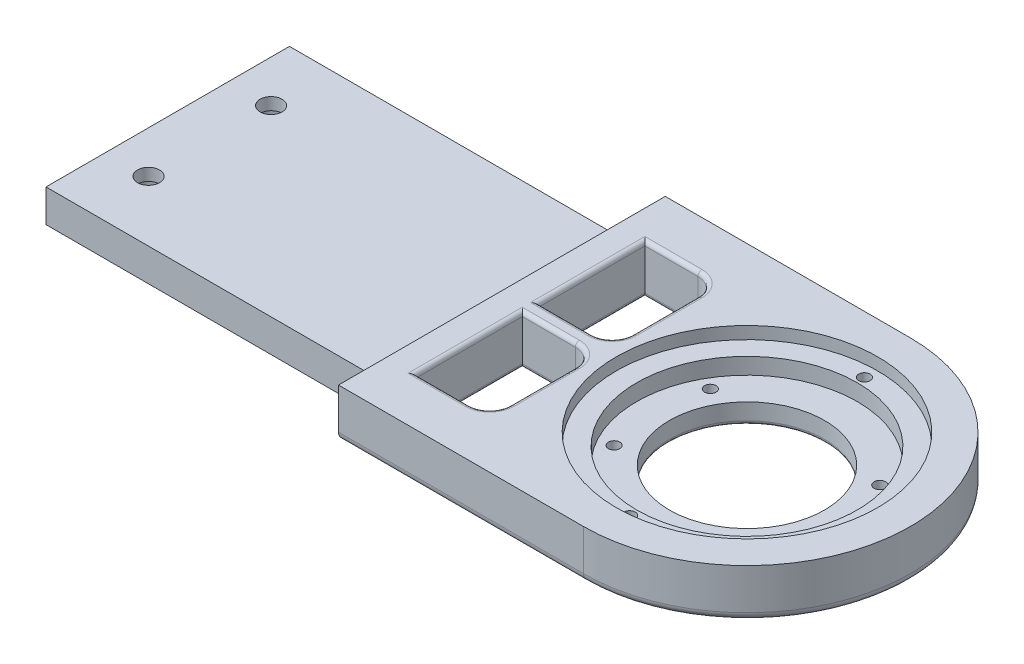
from build123d import *

# Parameters (mm, degrees)
SKETCH1_R                                         = 40
SKETCH1_R_2                                       = 19
BOSS_EXTRUDE1_DEPTH                               = 5
SKETCH2_R                                         = 40
SKETCH2_R_2                                       = 27
BOSS_EXTRUDE2_DEPTH                               = 4
SKETCH3_R                                         = 40
SKETCH3_R_2                                       = 32
BOSS_EXTRUDE3_DEPTH                               = 3
BOSS_EXTRUDE4_REACH                               = 92.244
BOSS_EXTRUDE4_END_RADIUS                          = 40
SKETCH6_W                                         = 12
SKETCH6_H                                         = 80
BOSS_EXTRUDE4_DIRECTION_2_DEPTH                   = 20
SKETCH9_W                                         = 60
SKETCH9_H                                         = 8
BOSS_EXTRUDE5_DEPTH                               = 82
SKETCH19_R                                        = 2.7
SKETCH19_W                                        = 18
SKETCH19_H                                        = 26
CUT_EXTRUDE8_DEPTH                                = 12
SKETCH5_R                                         = 1.4
SKETCH5_R_2                                       = 1.375
CUT_EXTRUDE1_HOLE_DEPTH                           = 149.013512897
CUT_EXTRUDE9_REALITY_DEPTH                        = 148.74302014
CUT_EXTRUDE9_REALITY_DEPTH_BACK                   = 148.74302014
CBORE_FOR_M5_HEX_HEAD_BOLT1_D                     = 5.4
CBORE_FOR_M5_HEX_HEAD_BOLT1_DEPTH                 = 17
CBORE_FOR_M5_HEX_HEAD_BOLT1_CBORE_D               = 8.4
CBORE_FOR_M5_HEX_HEAD_BOLT1_CBORE_DEPTH           = 5
CSK_FOR_M2_5_FLAT_HEAD_MACHINE_SCREW1_D           = 2.8
CSK_FOR_M2_5_FLAT_HEAD_MACHINE_SCREW1_CSINK_D     = 5.1
CSK_FOR_M2_5_FLAT_HEAD_MACHINE_SCREW1_CSINK_ANGLE = 90
FILLET1_5MM_R                                     = 5
FILLET2_2MM_R                                     = 2
FILLET3_1MM_R                                     = 1


with BuildPart() as part:
    # Sketch1 → Boss-Extrude1 (new body)
    with BuildSketch(Plane(origin=(0, 0, 0), x_dir=(1, 0, 0), z_dir=(0, 1, 0))):
        Circle(SKETCH1_R)
        Circle(SKETCH1_R_2, mode=Mode.SUBTRACT)
    extrude(amount=BOSS_EXTRUDE1_DEPTH)

    # Sketch2 → Boss-Extrude2 (add)
    with BuildSketch(Plane(origin=(0, 5, 0), x_dir=(1, 0, 0), z_dir=(0, 1, 0))):
        Circle(SKETCH2_R)
        Circle(SKETCH2_R_2, mode=Mode.SUBTRACT)
    extrude(amount=BOSS_EXTRUDE2_DEPTH)

    # Sketch3 → Boss-Extrude3 (add)
    with BuildSketch(Plane(origin=(0, 9, 0), x_dir=(1, 0, 0), z_dir=(0, 1, 0))):
        Circle(SKETCH3_R)
        Circle(SKETCH3_R_2, mode=Mode.SUBTRACT)
    extrude(amount=BOSS_EXTRUDE3_DEPTH)

    # Boss-Extrude4: up to this cylinder (the profile starts outside it)
    boss_extrude4_end = Plane(origin=(0, 6, 0), z_dir=(0, -1, 0)) * Cylinder(BOSS_EXTRUDE4_END_RADIUS, 265.488, mode=Mode.PRIVATE)
    # Sketch6 → Boss-Extrude4 (add, up to the surface)
    with BuildSketch(Plane(origin=(-40, 0, 0), x_dir=(0, -1, 0), z_dir=(-1, 0, 0)), mode=Mode.PRIVATE) as boss_extrude4_sk1:
        with Locations((-6, 0)):
            Rectangle(SKETCH6_W, SKETCH6_H)
    boss_extrude4_tool1 = extrude(boss_extrude4_sk1.sketch, amount=-BOSS_EXTRUDE4_REACH, mode=Mode.PRIVATE) - boss_extrude4_end
    add(boss_extrude4_tool1.solids().sort_by_distance((-40, 6, 0))[0])
    add(boss_extrude4_tool1.solids().sort_by_distance((-40, 6, 0))[1])

    # Sketch6 → Boss-Extrude4 direction 2 (add)
    with BuildSketch(Plane(origin=(-40, 0, 0), x_dir=(0, -1, 0), z_dir=(-1, 0, 0))):
        with Locations((-6, 0)):
            Rectangle(SKETCH6_W, SKETCH6_H)
    extrude(amount=BOSS_EXTRUDE4_DIRECTION_2_DEPTH)

    # Sketch9 → Boss-Extrude5 (add)
    with BuildSketch(Plane.ZY.offset(60)):
        with Locations((0, 4)):
            Rectangle(SKETCH9_W, SKETCH9_H)
    extrude(amount=BOSS_EXTRUDE5_DEPTH)

    # Sketch19 → Cut-Extrude8 (cut)
    with BuildSketch(Plane.XZ):
        with Locations((-131.5, 15)):
            Circle(SKETCH19_R)
        with Locations((-131.5, -15)):
            Circle(SKETCH19_R)
        with Locations((-44, 15)):
            Rectangle(SKETCH19_W, SKETCH19_H)
        with Locations((-44, -15)):
            Rectangle(SKETCH19_W, SKETCH19_H)
    extrude(amount=-CUT_EXTRUDE8_DEPTH, mode=Mode.SUBTRACT)

    # Sketch5 → Cut-Extrude1-Hole (cut, through all)
    with BuildSketch(Plane(origin=(0, 12, 0), x_dir=(1, 0, 0), z_dir=(0, 1, 0))):
        with Locations((-0.253069529, 28.998895769)):
            Circle(SKETCH5_R)
        with Locations((20.46369256, 12.05403612)):
            Circle(SKETCH5_R_2)
        with Locations((20.670947779, -11.695059552)):
            Circle(SKETCH5_R_2)
        with Locations((0.253069529, -28.998895769)):
            Circle(SKETCH5_R)
        with Locations((-20.46369256, -12.05403612)):
            Circle(SKETCH5_R_2)
        with Locations((-20.670947779, 11.695059552)):
            Circle(SKETCH5_R_2)
    extrude(amount=-CUT_EXTRUDE1_HOLE_DEPTH, mode=Mode.SUBTRACT)

    # Sketch22 → Cut-Extrude9-Reality (cut, two sides: drawn at the far end of the back side and taken through both)
    with BuildSketch(Plane(origin=(0, 8, 0), x_dir=(1, 0, 0), z_dir=(0, 1, 0)).offset(-CUT_EXTRUDE9_REALITY_DEPTH_BACK)):
        Polygon((-141.8, 29.8), (-141.8, -29.8), (-60.2, -29.8), (-60, -29.8), (-60, -30), (-142, -30), (-142, 30), (-60, 30), (-60, 29.8), (-60.2, 29.8), align=None)
    extrude(amount=CUT_EXTRUDE9_REALITY_DEPTH + CUT_EXTRUDE9_REALITY_DEPTH_BACK, mode=Mode.SUBTRACT)

    # CBORE for M5 Hex Head Bolt1
    with Locations(Plane(origin=(-131.5, 0, 15), x_dir=(0, 0, -1), z_dir=(0, -1, 0))):
        with Locations((0, 0), (30, 0)):
            CounterBoreHole(CBORE_FOR_M5_HEX_HEAD_BOLT1_D / 2, CBORE_FOR_M5_HEX_HEAD_BOLT1_CBORE_D / 2, CBORE_FOR_M5_HEX_HEAD_BOLT1_CBORE_DEPTH, depth=CBORE_FOR_M5_HEX_HEAD_BOLT1_DEPTH)

    # CSK for M2.5 Flat Head Machine Screw1 (through all)
    with Locations(Plane(origin=(-20.46369256, 0, 12.05403612), x_dir=(0, 0, -1), z_dir=(0, -1, 0))):
        with Locations((0, 0), (23.749095672, -0.207255219), (24.10807224, 40.92738512), (0.358976568, 41.134640339), (-16.944859649, 20.716762089), (41.052931889, 20.210623031)):
            CounterSinkHole(CSK_FOR_M2_5_FLAT_HEAD_MACHINE_SCREW1_D / 2, CSK_FOR_M2_5_FLAT_HEAD_MACHINE_SCREW1_CSINK_D / 2, counter_sink_angle=CSK_FOR_M2_5_FLAT_HEAD_MACHINE_SCREW1_CSINK_ANGLE)

    # Fillet1-5mm
    fillet1_5mm_edges = [part.edges().sort_by_distance(p)[0] for p in [
        (-35, 6, 2),
        (-35, 6, -2),
        (-35, 6, -28),
        (-35, 6, 28),
    ]]
    fillet(fillet1_5mm_edges, radius=FILLET1_5MM_R)

    # Fillet2-2mm
    fillet2_2mm_edges = [part.edges().sort_by_distance(p)[0] for p in [
        (-30, 0, 40),
        (-30, 0, -40),
        (40, 0, 0),
    ]]
    fillet(fillet2_2mm_edges, radius=FILLET2_2MM_R)

    # Fillet3-1mm
    fillet3_1mm_edges = [part.edges().sort_by_distance(p)[0] for p in [
        (-19, 0, 0),
        (-46.5, 12, 2),
        (-36.464466094, 12, 3.464466094),
        (-46.5, 12, -2),
        (-36.464466094, 12, -3.464466094),
        (-35, 12, 15),
        (-35, 12, -15),
        (-53, 12, 15),
        (-53, 12, -15),
        (-46.5, 0, 2),
        (-36.464466094, 0, 3.464466094),
        (-46.5, 0, -2),
        (-36.464466094, 0, -3.464466094),
        (-53, 0, -15),
        (-53, 0, 15),
        (-35, 0, 15),
        (-35, 0, -15),
        (-46.5, 0, 28),
        (-36.464466094, 0, 26.535533906),
        (-46.5, 0, -28),
        (-36.464466094, 0, -26.535533906),
        (-46.5, 12, 28),
        (-36.464466094, 12, 26.535533906),
        (-46.5, 12, -28),
        (-36.464466094, 12, -26.535533906),
    ]]
    fillet(fillet3_1mm_edges, radius=FILLET3_1MM_R)


solid = part.part
